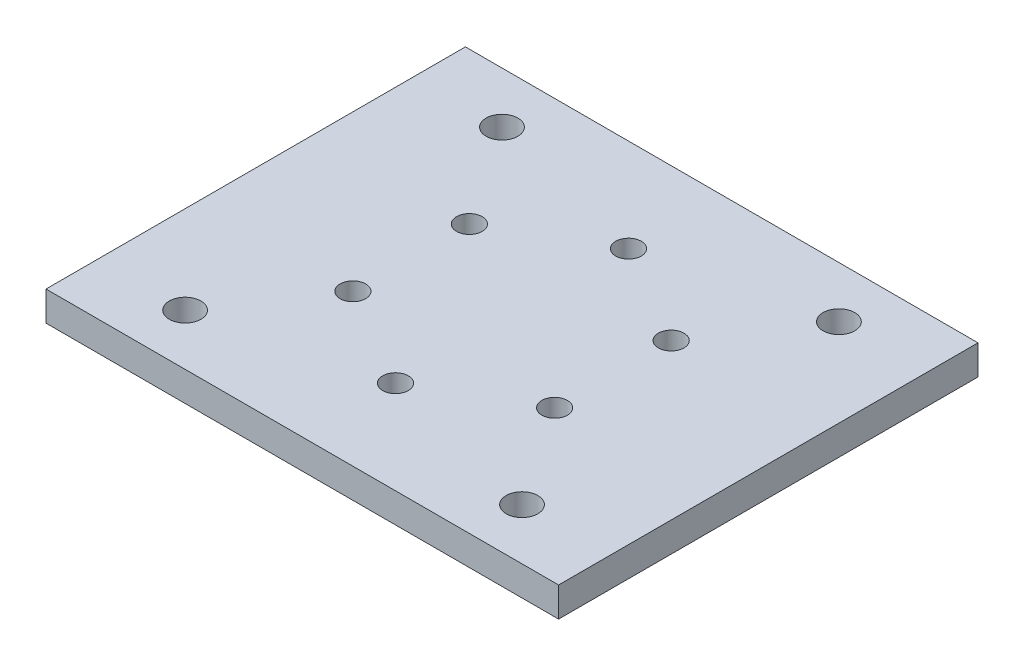
from build123d import *

# Parameters (mm, degrees)
SKETCH2_W            = 110
SKETCH2_H            = 90
BOSS_EXTRUDE1_DEPTH  = 6.35
SKETCH3_R            = 3.4
MOUNTING_HOLES_DEPTH = 143.268487375
SKETCH4_R            = 2.75
CUT_EXTRUDE1_DEPTH   = 143.268487375


with BuildPart() as part:
    # Sketch2 → Boss-Extrude1 (new body)
    with BuildSketch(Plane(origin=(0, 0, 0), x_dir=(1, 0, 0), z_dir=(0, 1, 0))):
        with Locations((55, 45)):
            Rectangle(SKETCH2_W, SKETCH2_H)
    extrude(amount=BOSS_EXTRUDE1_DEPTH)

    # Sketch3 → Mounting Holes (cut, through all)
    with BuildSketch(Plane(origin=(0, 6.35, 0), x_dir=(1, 0, 0), z_dir=(0, 1, 0))):
        with Locations(Location((18.85, 79, 0), (0, 0, 270))):
            Circle(SKETCH3_R)
        with Locations(Location((18.85, 11, 0), (0, 0, 90))):
            Circle(SKETCH3_R)
        with Locations(Location((91.15, 11, 0), (0, 0, 270))):
            Circle(SKETCH3_R)
        with Locations(Location((91.15, 79, 0), (0, 0, 90))):
            Circle(SKETCH3_R)
    extrude(amount=-MOUNTING_HOLES_DEPTH, mode=Mode.SUBTRACT)

    # Sketch4 → Cut-Extrude1 (cut, through all)
    with BuildSketch(Plane(origin=(0, 6.35, 0), x_dir=(1, 0, 0), z_dir=(0, 1, 0))):
        with Locations(Location((55, 70, 0), (0, 0, 270))):
            Circle(SKETCH4_R)
        with Locations(Location((76.650635095, 57.5, 0), (0, 0, 270))):
            Circle(SKETCH4_R)
        with Locations(Location((76.650635095, 32.5, 0), (0, 0, 270))):
            Circle(SKETCH4_R)
        with Locations(Location((55, 20, 0), (0, 0, 270))):
            Circle(SKETCH4_R)
        with Locations(Location((33.349364905, 32.5, 0), (0, 0, 270))):
            Circle(SKETCH4_R)
        with Locations(Location((33.349364905, 57.5, 0), (0, 0, 270))):
            Circle(SKETCH4_R)
    extrude(amount=-CUT_EXTRUDE1_DEPTH, mode=Mode.SUBTRACT)


solid = part.part
